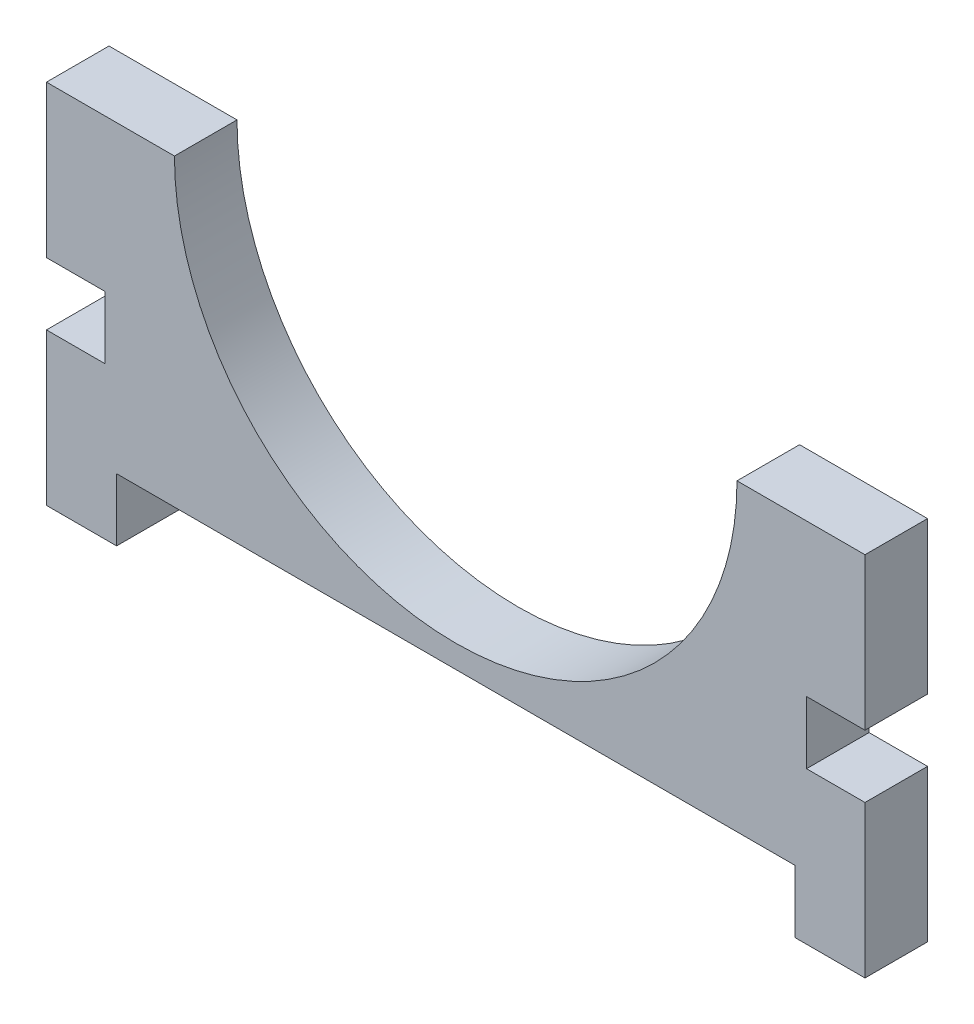
from build123d import *

# Parameters (mm, degrees)
BOSS_EXTRUDE1_DEPTH = 5.35


with BuildPart() as part:
    # Model → Boss-Extrude1 (new body)
    with BuildSketch(Plane.XY):
        with BuildLine():
            Line((70.000000298, 31.350001693), (59.055000544, 31.350001693))
            ThreePointArc((59.055000544, 31.350001693), (35.000000149, 7.295001298), (10.944999754, 31.350001693))
            Line((10.944999754, 31.350001693), (0, 31.350001693))
            Line((0, 31.350001693), (0, 18.349999562))
            Line((0, 18.349999562), (4.999999888, 18.349999562))
            Line((4.999999888, 18.349999562), (4.999999888, 13.000000268))
            Line((4.999999888, 13.000000268), (0, 13.000000268))
            Line((0, 13.000000268), (0, 0))
            Line((0, 0), (6.000000052, 0))
            Line((6.000000052, 0), (6.000000052, 5.350000225))
            Line((6.000000052, 5.350000225), (64.00000304, 5.350000225))
            Line((64.00000304, 5.350000225), (64.00000304, 0))
            Line((64.00000304, 0), (70.000000298, 0))
            Line((70.000000298, 0), (70.000000298, 13.000000268))
            Line((70.000000298, 13.000000268), (64.999997616, 13.000000268))
            Line((64.999997616, 13.000000268), (64.999997616, 18.349999562))
            Line((64.999997616, 18.349999562), (70.000000298, 18.349999562))
            Line((70.000000298, 18.349999562), (70.000000298, 31.350001693))
        make_face()
    extrude(amount=BOSS_EXTRUDE1_DEPTH)


solid = part.part
